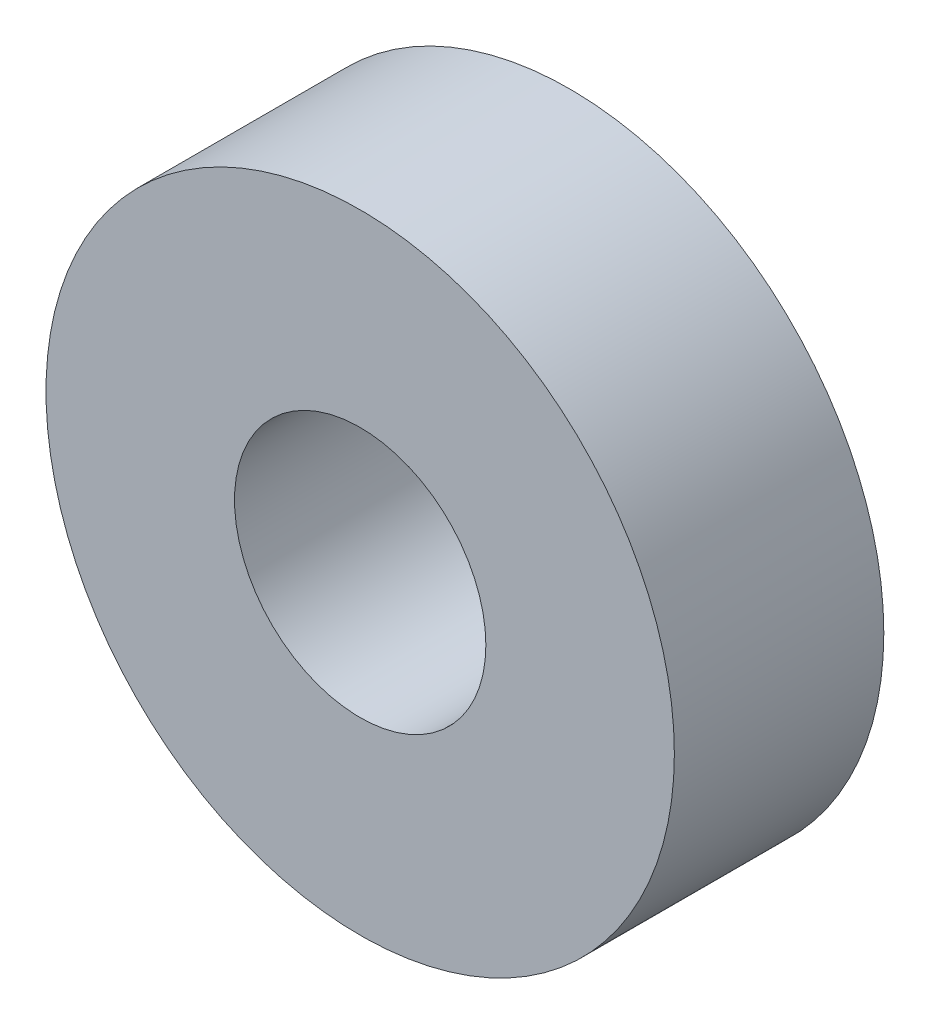
from build123d import *

# Parameters (mm, degrees)
SKETCH_1_R      = 7.5
SKETCH_1_R_2    = 3
EXTRUDE_1_DEPTH = 5


with BuildPart() as part:
    # 草图1 → 凸台-拉伸1 (new body)
    with BuildSketch(Plane.XY):
        Circle(SKETCH_1_R)
        Circle(SKETCH_1_R_2, mode=Mode.SUBTRACT)
    extrude(amount=EXTRUDE_1_DEPTH)


solid = part.part
